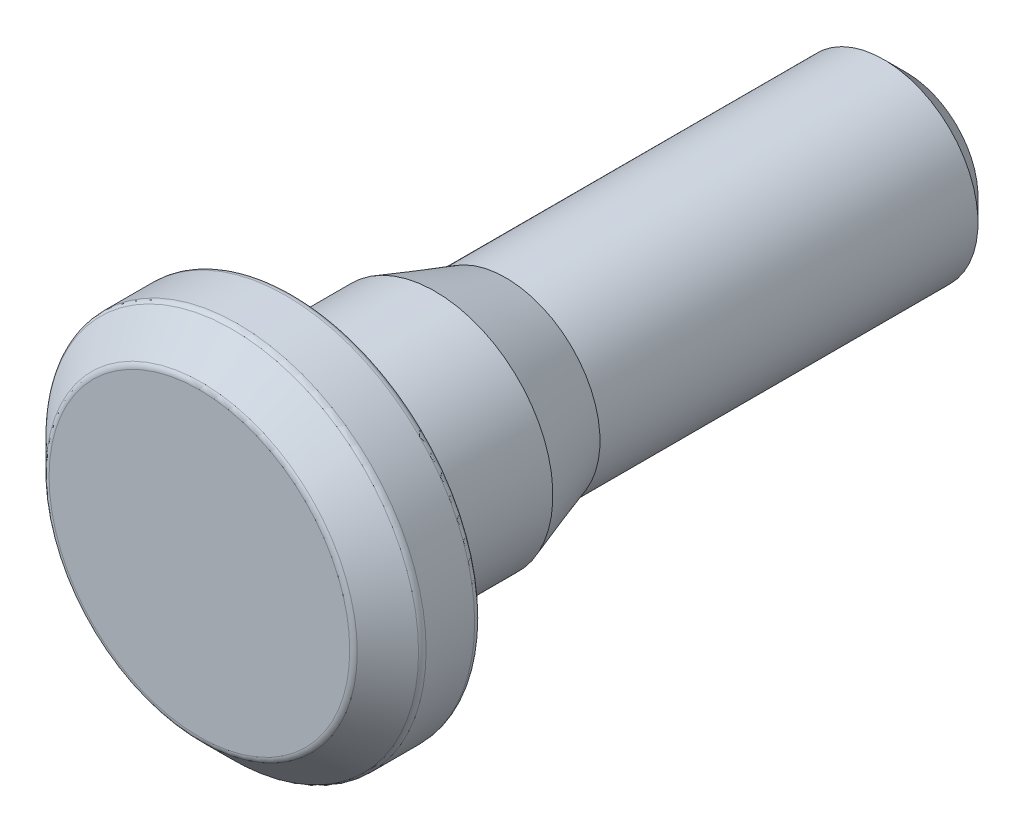
from build123d import *

# Parameters (mm, degrees)
FILLET1_R = 0.508


with BuildPart() as part:
    # Sketch1 → Base-Revolve (revolve)
    with BuildSketch(Plane(origin=(0, 0, 0), x_dir=(0, 0, -1), z_dir=(1, 0, 0)), mode=Mode.PRIVATE) as base_revolve_sk:
        Polygon((-6.35, 0), (41.275, 0), (41.275, 4.826), (39.751, 6.35), (14.2875, 6.35), (9.525, 7.9375), (0, 7.9375), (0, 12.7), (-3.9878, 12.7), (-6.35, 10.3378), align=None)
    revolve(base_revolve_sk.sketch.rotate(Axis((0, 0, 0), (0, 0, 1)), 90), axis=Axis((0, 0, 0), (0, 0, 1)))

    # Fillet1
    fillet1_edges = [part.edges().sort_by_distance(p)[0] for p in [
        (7.9375, 0, 0),
        (12.7, 0, 0),
        (12.7, 0, 3.9878),
        (10.3378, 0, 6.35),
    ]]
    fillet(fillet1_edges, radius=FILLET1_R)


solid = part.part
